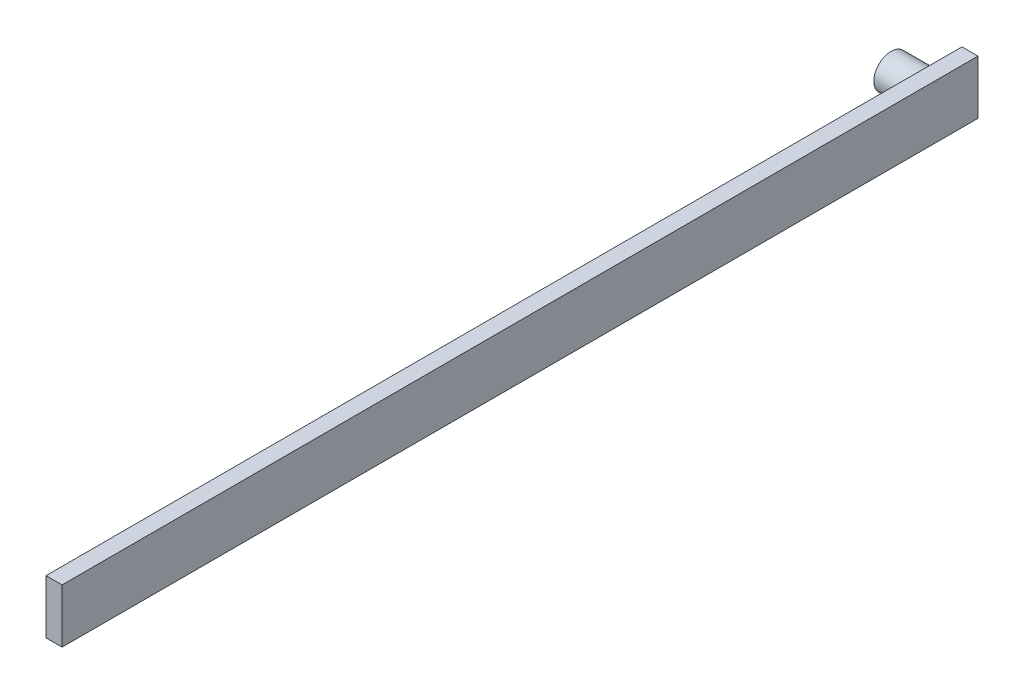
from build123d import *

# Parameters (mm, degrees)
SKETCH1_R           = 7.5
BOSS_EXTRUDE1_DEPTH = 18
SKETCH2_W           = 399.543241252
SKETCH2_H           = 23.51775922
BOSS_EXTRUDE2_DEPTH = 7


with BuildPart() as part:
    # Sketch1 → Boss-Extrude1 (new body)
    with BuildSketch(Plane(origin=(0, 0, 0), x_dir=(0, 0, -1), z_dir=(1, 0, 0))):
        Circle(SKETCH1_R)
    extrude(amount=BOSS_EXTRUDE1_DEPTH)

    # Sketch2 → Boss-Extrude2 (add)
    with BuildSketch(Plane(origin=(18, 0, 0), x_dir=(0, 0, -1), z_dir=(1, 0, 0))):
        with Locations((-186.816113962, 0)):
            Rectangle(SKETCH2_W, SKETCH2_H)
    extrude(amount=BOSS_EXTRUDE2_DEPTH)


solid = part.part
